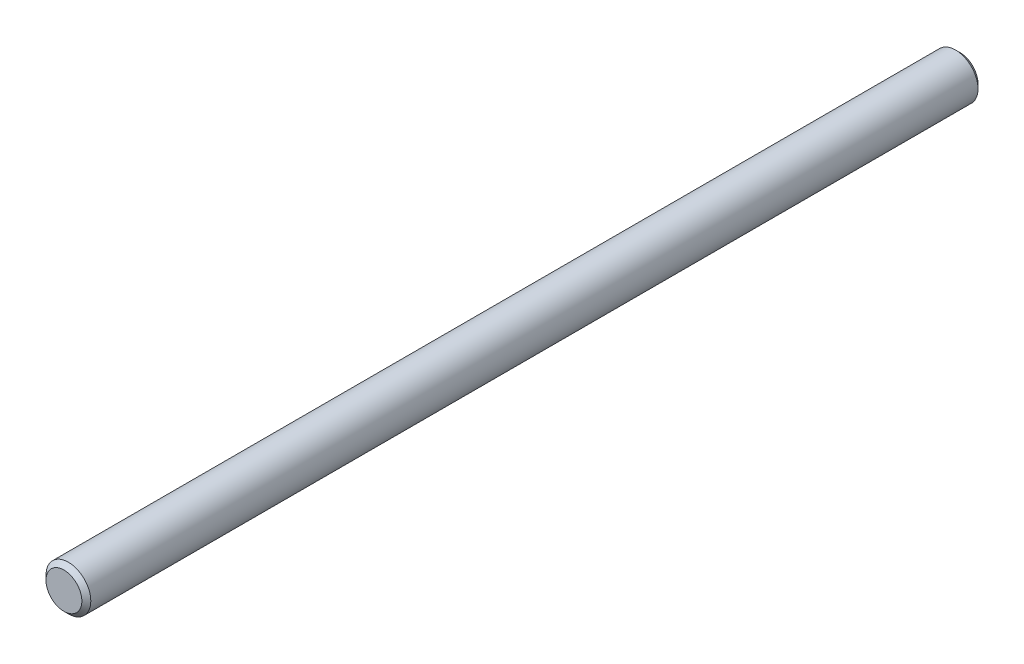
from build123d import *

# Parameters (mm, degrees)
SKETCH3_R           = 3.175
BOSS_EXTRUDE1_DEPTH = 63.5
CHAMFER1_SIZE       = 0.635


with BuildPart() as part:
    # Sketch3 → Boss-Extrude1 (new, symmetric)
    with BuildSketch(Plane.XY):
        Circle(SKETCH3_R)
    extrude(amount=BOSS_EXTRUDE1_DEPTH, both=True)

    # Chamfer1
    chamfer1_edges = [part.edges().sort_by_distance(p)[0] for p in [
        (-3.175, 0, -63.5),
        (-3.175, 0, 63.5),
    ]]
    chamfer(chamfer1_edges, length=CHAMFER1_SIZE)


solid = part.part
